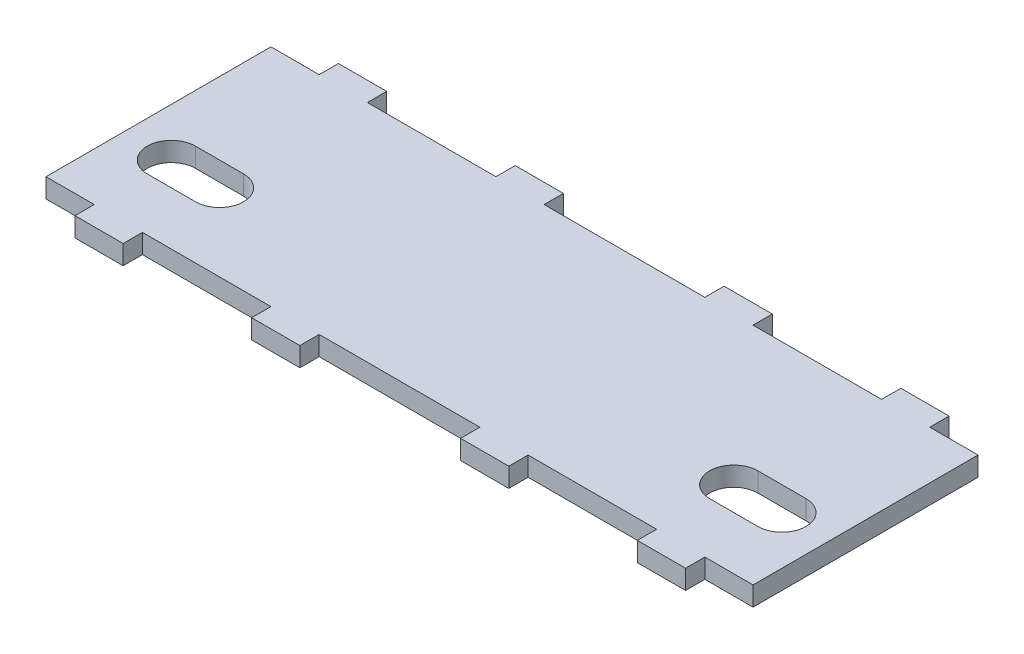
from build123d import *

# Parameters (mm, degrees)
BOSS_EXTRUDE1_DEPTH = 6
CUT_EXTRUDE1_DEPTH  = 10


with BuildPart() as part:
    # Sketch1 → Boss-Extrude1 (new body)
    with BuildSketch(Plane(origin=(0, 0, 0), x_dir=(1, 0, 0), z_dir=(0, 1, 0))):
        Polygon((-160.386748432, 60.5), (-145.386748432, 60.5), (-145.386748432, -9.5), (-160.386748432, -9.5), (-160.386748432, -15.5), (-175.386748432, -15.5), (-175.386748432, -9.5), (-215.386748432, -9.5), (-215.386748432, -15.5), (-230.386748432, -15.5), (-230.386748432, -9.5), (-280.386748432, -9.5), (-280.386748432, -15.5), (-295.386748432, -15.5), (-295.386748432, -9.5), (-335.386748432, -9.5), (-335.386748432, -15.5), (-350.386748432, -15.5), (-350.386748432, -9.5), (-365.386748432, -9.5), (-365.386748432, 60.5), (-350.386748432, 60.5), (-350.386748432, 66.5), (-335.386748432, 66.5), (-335.386748432, 60.5), (-295.386748432, 60.5), (-295.386748432, 66.5), (-280.386748432, 66.5), (-280.386748432, 60.5), (-230.386748432, 60.5), (-230.386748432, 66.5), (-215.386748432, 66.5), (-215.386748432, 60.5), (-175.386748432, 60.5), (-175.386748432, 66.5), (-160.386748432, 66.5), align=None)
    extrude(amount=BOSS_EXTRUDE1_DEPTH)

    # Sketch2 → Cut-Extrude1 (cut)
    with BuildSketch(Plane.XZ):
        with BuildLine():
            Line((-350.386748432, -7), (-335.386748432, -7))
            ThreePointArc((-335.386748432, -7), (-327.886748432, -14.5), (-335.386748432, -22))
            Line((-335.386748432, -22), (-350.386748432, -22))
            ThreePointArc((-350.386748432, -22), (-357.886748432, -14.5), (-350.386748432, -7))
        make_face()
        with BuildLine():
            Line((-175.386748432, -22), (-160.386748432, -22))
            ThreePointArc((-160.386748432, -22), (-152.886748432, -14.5), (-160.386748432, -7))
            Line((-160.386748432, -7), (-175.386748432, -7))
            ThreePointArc((-175.386748432, -7), (-182.886748432, -14.5), (-175.386748432, -22))
        make_face()
    extrude(amount=-CUT_EXTRUDE1_DEPTH, mode=Mode.SUBTRACT)


solid = part.part
